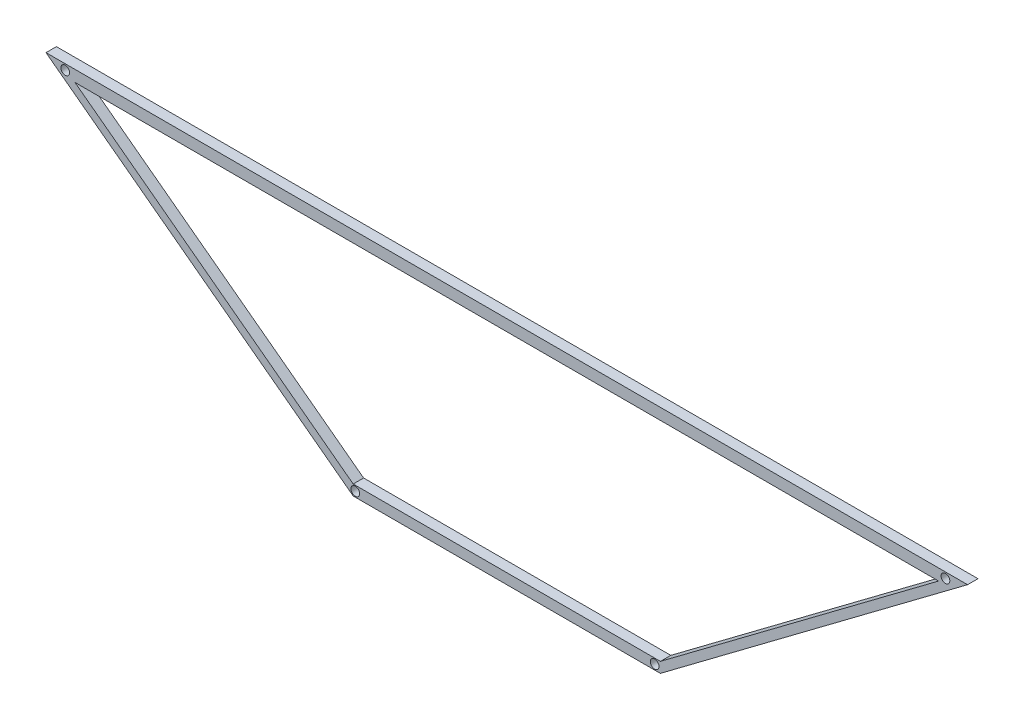
from build123d import *

# Parameters (mm, degrees)
BOSS_EXTRUDE2_DEPTH = 13.56
SKETCH5_R           = 5.7
CUT_EXTRUDE1_DEPTH  = 1002.036692109


with BuildPart() as part:
    # Sketch4 → Boss-Extrude2 (new body)
    with BuildSketch(Plane.XY):
        Polygon((-225.81606276, 70.095146264), (974.18393724, 70.095146264), (574.18393724, -229.904853736), (174.18393724, -229.904853736), align=None)
        Polygon((574.18393724, -216.344853736), (936.447387254, 55.352733774), (-188.079512773, 55.352733774), (174.18393724, -216.344853736), align=None, mode=Mode.SUBTRACT)
    extrude(amount=BOSS_EXTRUDE2_DEPTH)

    # Sketch5 → Cut-Extrude1 (cut, through all)
    with BuildSketch(Plane.XY.offset(13.56)):
        with Locations((945.339868666, 62.77782)):
            Circle(SKETCH5_R)
        with Locations((-200.789433704, 62.77782)):
            Circle(SKETCH5_R)
        with Locations((176.91916089, -223.073008716)):
            Circle(SKETCH5_R)
        with Locations((566.674885297, -223.073008716)):
            Circle(SKETCH5_R)
    extrude(amount=-CUT_EXTRUDE1_DEPTH, mode=Mode.SUBTRACT)


solid = part.part
